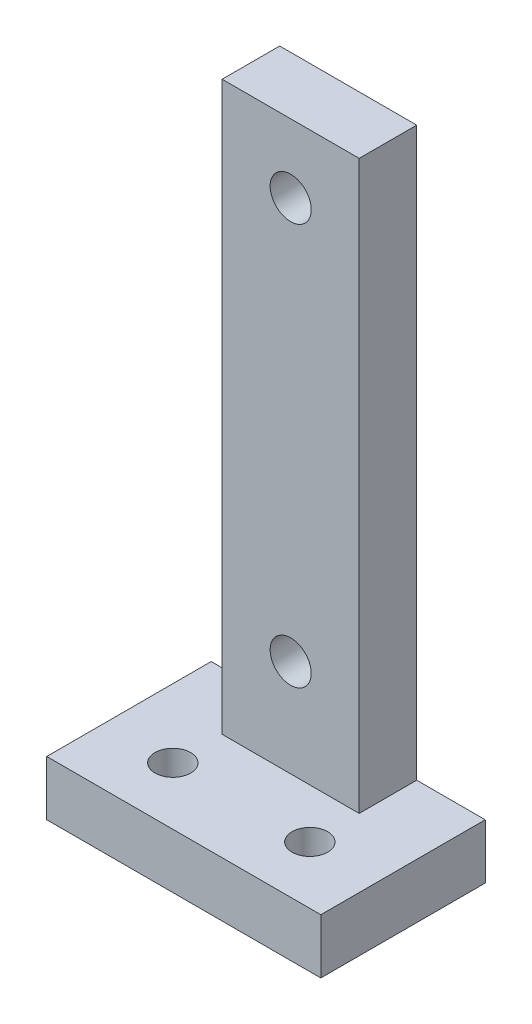
from build123d import *

# Parameters (mm, degrees)
SKETCH1_W           = 25.4
SKETCH1_H           = 15.24
BOSS_EXTRUDE1_DEPTH = 5.08
SKETCH2_R           = 1.651
CUT_EXTRUDE1_DEPTH  = 119.490202326
SKETCH3_W           = 12.7
SKETCH3_H           = 5.334
BOSS_EXTRUDE2_DEPTH = 52.578
SKETCH4_R           = 1.905
CUT_EXTRUDE2_DEPTH  = 115.262072587


with BuildPart() as part:
    # Sketch1 → Boss-Extrude1 (new body)
    with BuildSketch(Plane(origin=(0, 0, 0), x_dir=(1, 0, 0), z_dir=(0, 1, 0))):
        with Locations((-88.261608108, 54.193229454)):
            Rectangle(SKETCH1_W, SKETCH1_H)
    extrude(amount=-BOSS_EXTRUDE1_DEPTH)

    # Sketch2 → Cut-Extrude1 (cut, through all)
    with BuildSketch(Plane(origin=(0, 0, 0), x_dir=(1, 0, 0), z_dir=(0, 1, 0))):
        with Locations(Location((-94.611608108, 51.907229454, 0), (0, 0, 270))):
            Circle(SKETCH2_R)
        with Locations(Location((-81.911608108, 51.907229454, 0), (0, 0, 270))):
            Circle(SKETCH2_R)
    extrude(amount=-CUT_EXTRUDE1_DEPTH, mode=Mode.SUBTRACT)

    # Sketch3 → Boss-Extrude2 (add)
    with BuildSketch(Plane(origin=(0, 0, 0), x_dir=(1, 0, 0), z_dir=(0, 1, 0))):
        with Locations((-88.261608108, 59.146229454)):
            Rectangle(SKETCH3_W, SKETCH3_H)
    extrude(amount=BOSS_EXTRUDE2_DEPTH)

    # Sketch4 → Cut-Extrude2 (cut, through all)
    with BuildSketch(Plane.XY.offset(-56.479229454)):
        with Locations((-88.261608108, 46.228)):
            Circle(SKETCH4_R)
        with Locations((-88.261608108, 9.017)):
            Circle(SKETCH4_R)
    extrude(amount=-CUT_EXTRUDE2_DEPTH, mode=Mode.SUBTRACT)


solid = part.part
